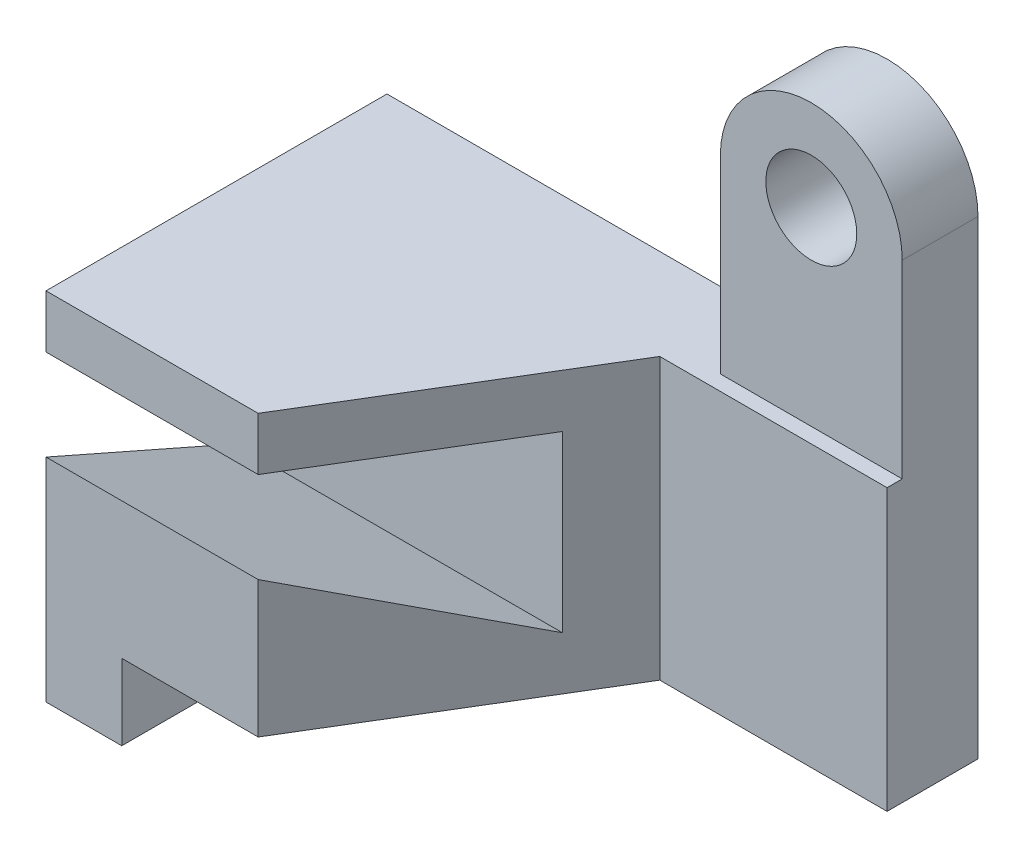
from build123d import *

# Parameters (mm, degrees)
BOSS_EXTRUDE1_DEPTH = 18.5
CUT_EXTRUDE1_DEPTH  = 92.930680406
SKETCH3_W           = 24
SKETCH3_H           = 10
BOSS_EXTRUDE2_DEPTH = 25
SKETCH4_R           = 12
SKETCH4_R_2         = 6
BOSS_EXTRUDE4_DEPTH = 10
SKETCH5_R           = 6
CUT_EXTRUDE2_DEPTH  = 102.927670433
SKETCH6_W           = 10
SKETCH6_H           = 10
BOSS_EXTRUDE5_DEPTH = 45


with BuildPart() as part:
    # Sketch1 → Boss-Extrude1 (new, symmetric)
    with BuildSketch(Plane(origin=(0, 0, 0), x_dir=(-1, 0, 0), z_dir=(0, 1, 0))):
        Polygon((0, 0), (78, 0), (78, 45), (50, 45), (30, 12), (0, 12), align=None)
    extrude(amount=BOSS_EXTRUDE1_DEPTH, both=True)

    # Sketch2 → Cut-Extrude1 (cut, through all)
    with BuildSketch(Plane(origin=(-78, 0, 0), x_dir=(0, -1, 0), z_dir=(-1, 0, 0))):
        Polygon((0.5, 45), (-11.5, 45), (-11.5, 20), (11.5, 20), align=None)
    extrude(amount=-CUT_EXTRUDE1_DEPTH, mode=Mode.SUBTRACT)

    # Sketch3 → Boss-Extrude2 (add)
    with BuildSketch(Plane(origin=(0, 18.5, 0), x_dir=(-1, 0, 0), z_dir=(0, 1, 0))):
        with Locations((12, 5)):
            Rectangle(SKETCH3_W, SKETCH3_H)
    extrude(amount=BOSS_EXTRUDE2_DEPTH)

    # Sketch4 → Boss-Extrude4 (add)
    with BuildSketch(Plane.XY.offset(10)):
        with Locations((-12, 43.5)):
            Circle(SKETCH4_R)
        with Locations((-12, 43.5)):
            Circle(SKETCH4_R_2, mode=Mode.SUBTRACT)
    extrude(amount=-BOSS_EXTRUDE4_DEPTH)

    # Sketch5 → Cut-Extrude2 (cut, through all)
    with BuildSketch(Plane.XY.offset(10)):
        with Locations((-12, 43.5)):
            Circle(SKETCH5_R)
    extrude(amount=-CUT_EXTRUDE2_DEPTH, mode=Mode.SUBTRACT)

    # Sketch6 → Boss-Extrude5 (add)
    with BuildSketch(Plane.XY.offset(45)):
        with Locations((-73, -23.5)):
            Rectangle(SKETCH6_W, SKETCH6_H)
    extrude(amount=-BOSS_EXTRUDE5_DEPTH)


solid = part.part
